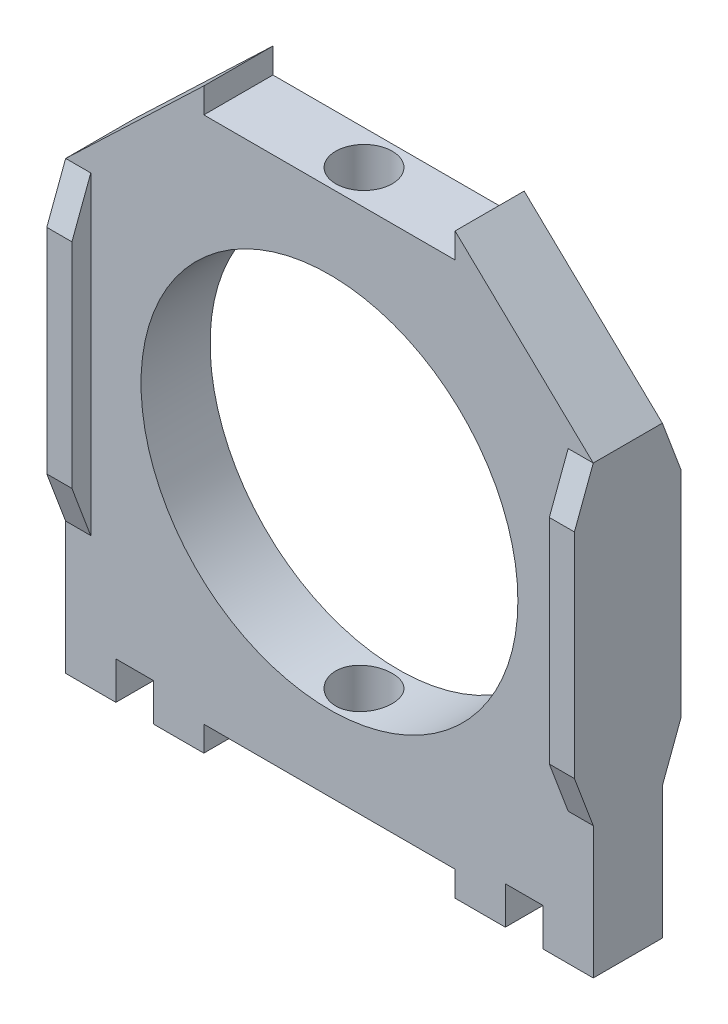
from build123d import *

# Parameters (mm, degrees)
SKETCH1_R            = 15
BOSS_EXTRUDE1_DEPTH  = 2.75
SKETCH1_3_W          = 2
SKETCH1_3_H          = 25
BOSS_EXTRUDE2_DEPTH  = 4.25
CUT_EXTRUDE1_DEPTH   = 49.073511417
M4_CLEARANCE_HOLE1_D = 4.5


with BuildPart() as part:
    # Sketch1 → Boss-Extrude1 (new, symmetric)
    with BuildSketch(Plane.XY):
        Polygon((19, 12.5), (21, 12.5), (10, 23), (10, 21), (-10, 21), (-10, 23), (-21, 12.5), (-19, 12.5), (-19, -12.5), (-21, -12.5), (-21, -23), (-17, -23), (-17, -20), (-14, -20), (-14, -23), (-10, -23), (-10, -21), (10, -21), (10, -23), (14, -23), (14, -20), (17, -20), (17, -23), (21, -23), (21, -12.5), (19, -12.5), align=None)
        Circle(SKETCH1_R, mode=Mode.SUBTRACT)
    extrude(amount=BOSS_EXTRUDE1_DEPTH, both=True)

    # Sketch1<3> → Boss-Extrude2 (add, symmetric)
    with BuildSketch(Plane.XY):
        with Locations((20, 0)):
            Rectangle(SKETCH1_3_W, SKETCH1_3_H)
        with Locations((-20, 0)):
            Rectangle(SKETCH1_3_W, SKETCH1_3_H)
    extrude(amount=BOSS_EXTRUDE2_DEPTH, both=True)

    # Sketch2 → Cut-Extrude1 (cut, through all)
    with BuildSketch(Plane.ZY.offset(21)):
        Polygon((-4.25, 8.5), (-2.75, 12.5), (-4.25, 12.5), align=None)
        Polygon((4.25, 12.5), (2.75, 12.5), (4.25, 8.5), align=None)
        Polygon((-2.75, -12.5), (-4.25, -8.5), (-4.25, -12.5), align=None)
        Polygon((4.25, -12.5), (4.25, -8.5), (2.75, -12.5), align=None)
    extrude(amount=-CUT_EXTRUDE1_DEPTH, mode=Mode.SUBTRACT)

    # M4 Clearance Hole1 (through all)
    with Locations(Plane(origin=(0, 21, 0), x_dir=(1, 0, 0), z_dir=(0, 1, 0))):
        with Locations((0, 0)):
            Hole(M4_CLEARANCE_HOLE1_D / 2)


solid = part.part
